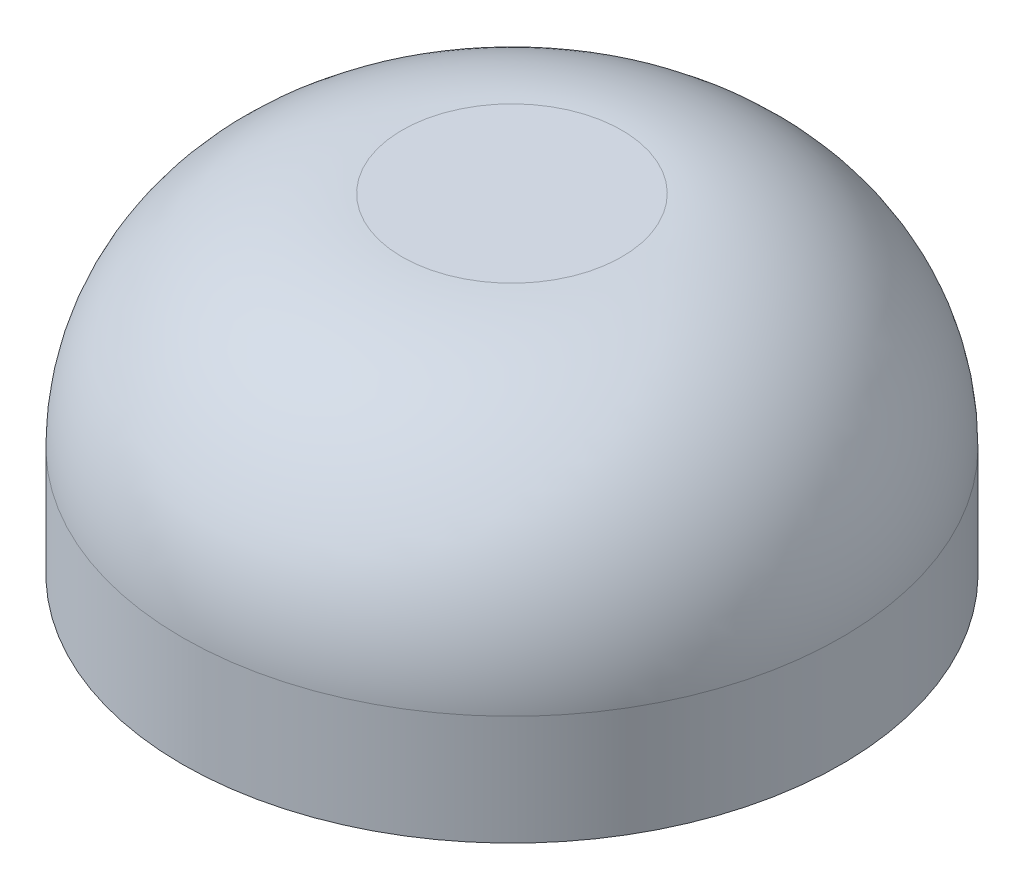
from build123d import *

# Parameters (mm, degrees)
ESQUISSE1_R        = 15
BOSS_EXTRU_1_DEPTH = 15
CONG_1_R           = 10


with BuildPart() as part:
    # Esquisse1 → Boss.-Extru.1 (new body)
    with BuildSketch(Plane(origin=(0, 0, 0), x_dir=(1, 0, 0), z_dir=(0, 1, 0))):
        with Locations(Location((0, 0, 0), (0, 0, 270))):
            Circle(ESQUISSE1_R)
    extrude(amount=BOSS_EXTRU_1_DEPTH)

    # Congé1
    cong_1_edges = [part.edges().sort_by_distance(p)[0] for p in [
        (0, 15, -15),
    ]]
    fillet(cong_1_edges, radius=CONG_1_R)


solid = part.part
